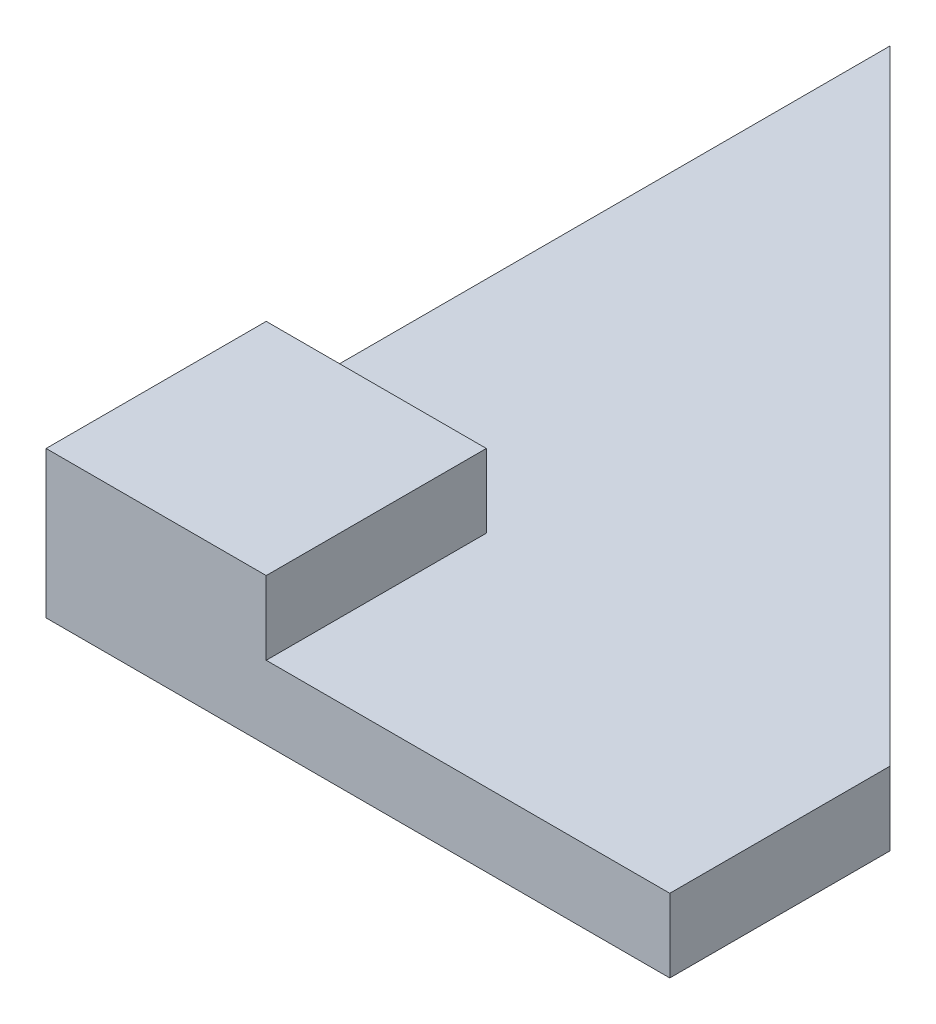
from build123d import *

# Parameters (mm, degrees)
SKETCH1_W           = 30
SKETCH1_H           = 30
BOSS_EXTRUDE1_DEPTH = 10
SKETCH3_W           = 55
SKETCH3_H           = 30
SKETCH3_W_2         = 30
BOSS_EXTRUDE3_DEPTH = 10


with BuildPart() as part:
    # Sketch1 → Boss-Extrude1 (new body)
    with BuildSketch(Plane(origin=(0, 0, 0), x_dir=(1, 0, 0), z_dir=(0, 1, 0))):
        Rectangle(SKETCH1_W, SKETCH1_H)
    extrude(amount=BOSS_EXTRUDE1_DEPTH)

    # Sketch3 → Boss-Extrude3 (add)
    with BuildSketch(Plane.XZ):
        with Locations((42.5, 0)):
            Rectangle(SKETCH3_W, SKETCH3_H)
        Polygon((-15, -15), (-15, -100), (70, -15), (15, -15), align=None)
        Rectangle(SKETCH3_W_2, SKETCH3_H)
    extrude(amount=BOSS_EXTRUDE3_DEPTH)


solid = part.part
